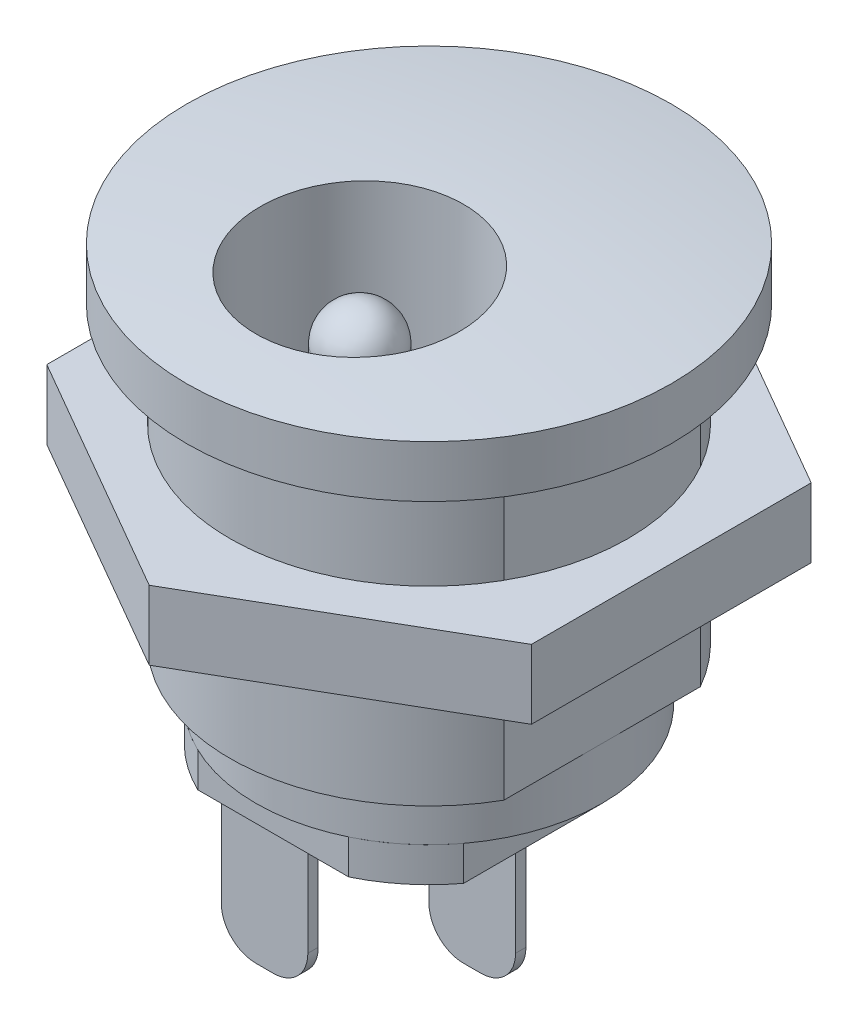
from build123d import *

# Parameters (mm, degrees)
SKETCH1_R               = 7
BOSS_EXTRUDE1_DEPTH     = 1.5
DOME1_FACE_RADIUS       = 7
DOME1_HEIGHT            = 0.5
SKETCH2_R               = 5.75
BOSS_EXTRUDE2_DEPTH     = 8.5
SKETCH3_R               = 5
BOSS_EXTRUDE3_DEPTH     = 1.5
CUT_EXTRUDE1_START      = -8.5
CUT_EXTRUDE1_DEPTH      = 8.5
BOSS_EXTRUDE5_DEPTH     = 1
CUT_EXTRUDE2_DEPTH      = 8
CUT_EXTRUDE2_DEPTH_BACK = 15.798648587
SKETCH6_R               = 3
SKETCH7_R               = 1.05
BOSS_EXTRUDE6_DEPTH     = 8
DOME2_FACE_RADIUS       = 1.05
DOME2_HEIGHT            = 1.05
BOSS_EXTRUDE7_START     = 3
SKETCH8_R               = 5.75
BOSS_EXTRUDE7_DEPTH     = 2
SKETCH9_W               = 2.5
SKETCH9_H               = 0.3
SKETCH9_W_2             = 0.3
SKETCH9_H_2             = 2.5
BOSS_EXTRUDE8_DEPTH     = 4.5
FILLET1_R               = 1


with BuildPart() as part:
    # Sketch1 → Boss-Extrude1 (new body)
    with BuildSketch(Plane(origin=(0, 0, 0), x_dir=(1, 0, 0), z_dir=(0, 1, 0))):
        with Locations(Location((0, 0, 0), (0, 0, 270))):
            Circle(SKETCH1_R)
    extrude(amount=BOSS_EXTRUDE1_DEPTH)

    # Dome1: a dome of height H over a round flat face of radius A is a cap of a sphere of radius (A * A + H * H) / (2 * H)
    dome1_r = (DOME1_FACE_RADIUS * DOME1_FACE_RADIUS + DOME1_HEIGHT * DOME1_HEIGHT) / (2 * DOME1_HEIGHT)
    dome1_base = Plane((0, 1.5, 0), z_dir=(0, 1, 0))
    with Locations(dome1_base.offset(DOME1_HEIGHT - dome1_r)):
        dome1_ball = Sphere(dome1_r, mode=Mode.PRIVATE)
    add(split(dome1_ball, bisect_by=dome1_base, keep=Keep.TOP, mode=Mode.PRIVATE))

    # Sketch2 → Boss-Extrude2 (add)
    with BuildSketch(Plane.XZ):
        with Locations(Location((0, 0, 0), (0, 0, 270))):
            Circle(SKETCH2_R)
    extrude(amount=BOSS_EXTRUDE2_DEPTH)

    # Sketch3 → Boss-Extrude3 (add)
    with BuildSketch(Plane.XZ.offset(8.5)):
        with Locations(Location((0, 0, 0), (0, 0, 270))):
            Circle(SKETCH3_R)
    extrude(amount=BOSS_EXTRUDE3_DEPTH)

    # Sketch4 → Cut-Extrude1 (cut)
    with BuildSketch(Plane.XZ.offset(8.5).offset(CUT_EXTRUDE1_START)):
        with BuildLine():
            Line((-5, 2.839454173), (-5, -2.839454173))
            ThreePointArc((-5, -2.839454173), (-5.75, 0), (-5, 2.839454173))
        make_face()
        with BuildLine():
            Line((5, 2.839454173), (5, -2.839454173))
            ThreePointArc((5, -2.839454173), (5.75, 0), (5, 2.839454173))
        make_face()
    extrude(amount=CUT_EXTRUDE1_DEPTH, mode=Mode.SUBTRACT)

    # Sketch6 → Cut-Extrude2 (cut, two sides: drawn at the far end of the back side and taken through both)
    with BuildSketch(Plane.XZ.offset(-CUT_EXTRUDE2_DEPTH_BACK)):
        with Locations(Location((0, 2, 0), (0, 0, 224.887548927))):
            Circle(SKETCH6_R)
    extrude(amount=CUT_EXTRUDE2_DEPTH + CUT_EXTRUDE2_DEPTH_BACK, mode=Mode.SUBTRACT)

    # Sketch7 → Boss-Extrude6 (add)
    with BuildSketch(Plane(origin=(0, -8, 0), x_dir=(1, 0, 0), z_dir=(0, 1, 0))):
        with Locations(Location((0, -2, 0), (0, 0, 90))):
            Circle(SKETCH7_R)
    extrude(amount=BOSS_EXTRUDE6_DEPTH)

    # Dome2: a dome of height H over a round flat face of radius A is a cap of a sphere of radius (A * A + H * H) / (2 * H)
    dome2_r = (DOME2_FACE_RADIUS * DOME2_FACE_RADIUS + DOME2_HEIGHT * DOME2_HEIGHT) / (2 * DOME2_HEIGHT)
    dome2_base = Plane((0, 0, 2), z_dir=(0, 1, 0))
    with Locations(dome2_base.offset(DOME2_HEIGHT - dome2_r)):
        dome2_ball = Sphere(dome2_r, mode=Mode.PRIVATE)
    add(split(dome2_ball, bisect_by=dome2_base, keep=Keep.TOP, mode=Mode.PRIVATE))


with BuildPart() as body_2:
    # Sketch5 → Boss-Extrude5 (new body)
    with BuildSketch(Plane.XZ.offset(10)):
        with BuildLine():
            Line((-2.179449472, 4.5), (2.179449472, 4.5))
            ThreePointArc((2.179449472, 4.5), (3.179449472, 3.858898944), (4, 3))
            Line((4, 3), (4, -1))
            Line((4, -1), (2.5, -1))
            Line((2.5, -1), (2.5, -4.330127019))
            ThreePointArc((2.5, -4.330127019), (2.341265907, -4.417971701), (2.179449472, -4.5))
            Line((2.179449472, -4.5), (-2.179449472, -4.5))
            ThreePointArc((-2.179449472, -4.5), (-3.179449472, -3.858898944), (-4, -3))
            Line((-4, -3), (-4, 3))
            ThreePointArc((-4, 3), (-3.179449472, 3.858898944), (-2.179449472, 4.5))
        make_face()
    extrude(amount=BOSS_EXTRUDE5_DEPTH)

    # Sketch9 → Boss-Extrude8 (add)
    with BuildSketch(Plane.XZ.offset(11)):
        with Locations((-1.25, 3.35)):
            Rectangle(SKETCH9_W, SKETCH9_H)
        with Locations((1.75, 0.35)):
            Rectangle(SKETCH9_W, SKETCH9_H)
        with Locations((-3.35, -1.75)):
            Rectangle(SKETCH9_W_2, SKETCH9_H_2)
    extrude(amount=BOSS_EXTRUDE8_DEPTH)

    # Fillet1
    fillet1_edges = [body_2.edges().sort_by_distance(p)[0] for p in [
        (-2.5, -15.5, 3.35),
        (0, -15.5, 3.35),
        (0.5, -15.5, 0.35),
        (3, -15.5, 0.35),
        (-3.35, -15.5, -3),
        (-3.35, -15.5, -0.5),
    ]]
    fillet(fillet1_edges, radius=FILLET1_R)


with BuildPart() as body_3:
    # Sketch8 → Boss-Extrude7 (new body)
    with BuildSketch(Plane.XZ.offset(BOSS_EXTRUDE7_START)):
        Polygon((7, -4.041451884), (7, 4.041451884), (0, 8.082903769), (-7, 4.041451884), (-7, -4.041451884), (0, -8.082903769), align=None)
        with Locations(Location((0, 0, 0), (0, 0, 270))):
            Circle(SKETCH8_R, mode=Mode.SUBTRACT)
    extrude(amount=BOSS_EXTRUDE7_DEPTH)


solid = Compound([part.part, body_2.part, body_3.part])
